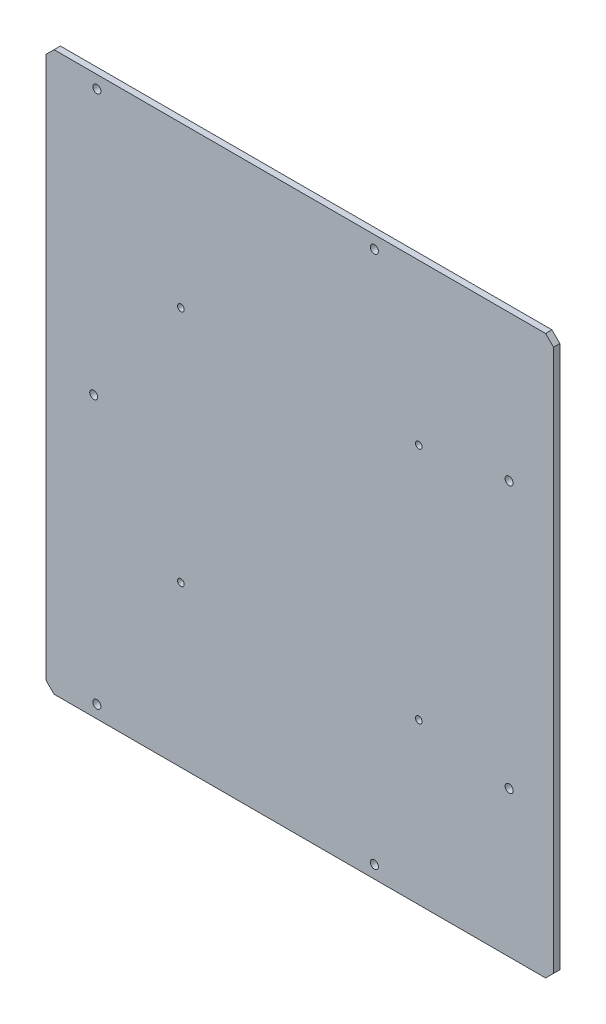
from build123d import *

# Parameters (mm, degrees)
BASE_DEPTH         = 4
SKETCH3_R          = 2.5
FITTINGHOLE_DEPTH  = 238.890731219
SKETCH4_R          = 2.55
CUT_EXTRUDE2_DEPTH = 238.890731219
SKETCH5_R          = 2.1
CUT_EXTRUDE3_DEPTH = 238.890731219


with BuildPart() as part:
    # Sketch1 → Base (new body)
    with BuildSketch(Plane.XY):
        Polygon((-155, 176), (-160, 171), (-160, -171), (-155, -176), (155, -176), (160, -171), (160, 171), (155, 176), align=None)
    extrude(amount=BASE_DEPTH)

    # Sketch3 → FittingHole (cut, through all)
    with BuildSketch(Plane(origin=(0, 0, 0), x_dir=(-1, 0, 0), z_dir=(0, 0, -1))):
        with Locations((130, 0)):
            Circle(SKETCH3_R)
    extrude(amount=-FITTINGHOLE_DEPTH, mode=Mode.SUBTRACT)

    # Sketch4 → Cut-Extrude2 (cut, through all)
    with BuildSketch(Plane.XY):
        with Locations((-128, 168)):
            Circle(SKETCH4_R)
        with Locations((47, 168)):
            Circle(SKETCH4_R)
        with Locations((132, 84)):
            Circle(SKETCH4_R)
        with Locations((132, -84)):
            Circle(SKETCH4_R)
        with Locations((47, -168)):
            Circle(SKETCH4_R)
        with Locations((-128, -168)):
            Circle(SKETCH4_R)
    extrude(amount=CUT_EXTRUDE2_DEPTH, mode=Mode.SUBTRACT)

    # Sketch5 → Cut-Extrude3 (cut, through all)
    with BuildSketch(Plane.XY.offset(4)):
        with Locations((-75, -75)):
            Circle(SKETCH5_R)
        with Locations(Location((75, -75, 0), (0, 0, 180))):
            Circle(SKETCH5_R)
        with Locations((75, 75)):
            Circle(SKETCH5_R)
        with Locations(Location((-75, 75, 0), (0, 0, 180))):
            Circle(SKETCH5_R)
    extrude(amount=-CUT_EXTRUDE3_DEPTH, mode=Mode.SUBTRACT)


solid = part.part
